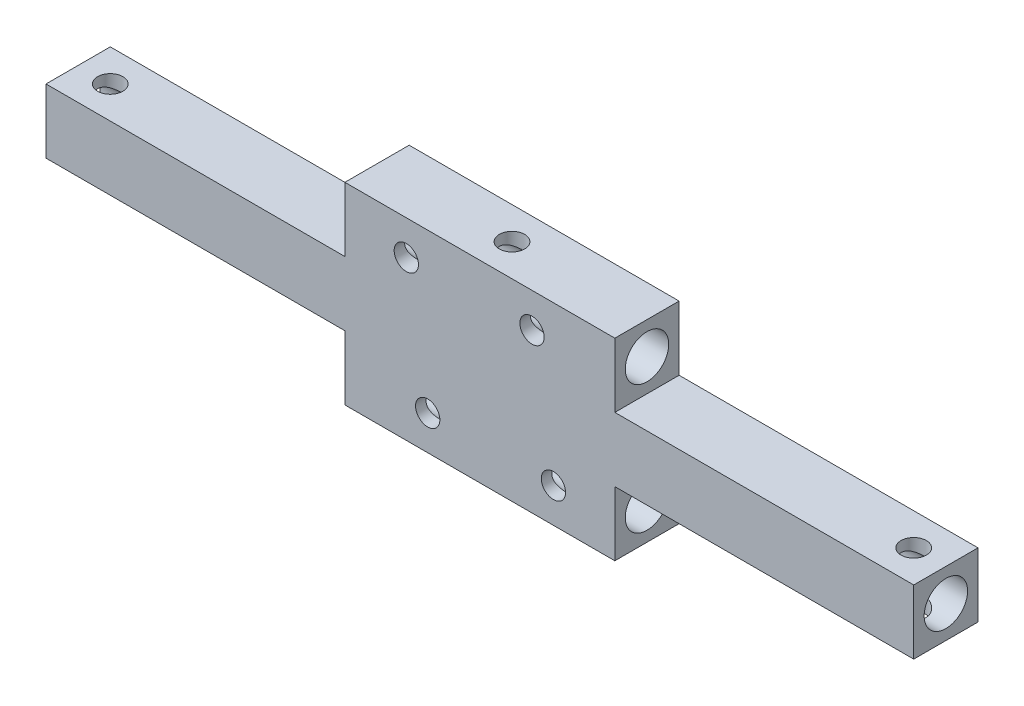
from build123d import *

# Parameters (mm, degrees)
SKETCH1_W           = 85.725
SKETCH1_H           = 6.35
SKETCH1_W_2         = 26.67
BOSS_EXTRUDE1_DEPTH = 6.35
SKETCH2_R           = 2.1463
CUT_EXTRUDE1_DEPTH  = 85.725
SKETCH4_R           = 2.1463
CUT_EXTRUDE2_DEPTH  = 26.67
SKETCH5_R           = 2.1463
CUT_EXTRUDE3_DEPTH  = 26.67
CUT_EXTRUDE4_REACH  = 49.333
SKETCH6_R           = 1.251498973
CUT_EXTRUDE6_REACH  = 47.153
SKETCH8_R           = 1.2
CUT_EXTRUDE7_REACH  = 47.153
SKETCH9_R           = 1.25


with BuildPart() as part:
    # Sketch1 → Boss-Extrude1 (new body)
    with BuildSketch(Plane.XY):
        with Locations((0, 3.175)):
            Rectangle(SKETCH1_W, SKETCH1_H)
        with Locations((0, -3.175)):
            Rectangle(SKETCH1_W_2, SKETCH1_H)
        with Locations((0, 9.525)):
            Rectangle(SKETCH1_W_2, SKETCH1_H)
    extrude(amount=BOSS_EXTRUDE1_DEPTH)

    # Sketch2 → Cut-Extrude1 (cut)
    with BuildSketch(Plane(origin=(42.8625, 0, 0), x_dir=(0, 0, -1), z_dir=(1, 0, 0))):
        with Locations(Location((-3.175, 3.175, 0), (0, 0, 90))):
            Circle(SKETCH2_R)
    extrude(amount=-CUT_EXTRUDE1_DEPTH, mode=Mode.SUBTRACT)

    # Sketch4 → Cut-Extrude2 (cut)
    with BuildSketch(Plane(origin=(13.335, 0, 0), x_dir=(0, 0, -1), z_dir=(1, 0, 0))):
        with Locations((-3.175, 9.525)):
            Circle(SKETCH4_R)
    extrude(amount=-CUT_EXTRUDE2_DEPTH, mode=Mode.SUBTRACT)

    # Sketch5 → Cut-Extrude3 (cut)
    with BuildSketch(Plane(origin=(13.335, 0, 0), x_dir=(0, 0, -1), z_dir=(1, 0, 0))):
        with Locations((-3.175, -3.175)):
            Circle(SKETCH5_R)
    extrude(amount=-CUT_EXTRUDE3_DEPTH, mode=Mode.SUBTRACT)

    # Cut-Extrude4: up to this face of the body (flat: up to its plane)
    cut_extrude4_end = Plane(part.part.faces().sort_by_distance((0, -6.35, 3.175))[0])
    # Sketch6 → Cut-Extrude4 (cut, up to the picked face)
    with BuildSketch(Plane(origin=(0, 12.7, 0), x_dir=(1, 0, 0), z_dir=(0, 1, 0)), mode=Mode.PRIVATE) as cut_extrude4_sk1:
        with Locations(Location((0, -3.175, 0), (0, 0, 270))):
            Circle(SKETCH6_R)
    cut_extrude4_tool1 = split(extrude(cut_extrude4_sk1.sketch, amount=-CUT_EXTRUDE4_REACH, mode=Mode.PRIVATE), bisect_by=cut_extrude4_end, keep=Keep.BOTH, mode=Mode.PRIVATE)
    add(cut_extrude4_tool1.solids().sort_by(Axis((0, 12.7, 3.175), (0, -1, 0)))[0], mode=Mode.SUBTRACT)

    # Cut-Extrude6: up to this face of the body (flat: up to its plane)
    cut_extrude6_end = Plane(part.part.faces().sort_by_distance((0, 3.175, 0))[0])
    # Sketch8 → Cut-Extrude6 (cut, up to the picked face)
    with BuildSketch(Plane.XY.offset(6.35), mode=Mode.PRIVATE) as cut_extrude6_sk1:
        with Locations((7.266656382, -2.944289585)):
            Circle(SKETCH8_R)
    cut_extrude6_tool1 = split(extrude(cut_extrude6_sk1.sketch, amount=-CUT_EXTRUDE6_REACH, mode=Mode.PRIVATE), bisect_by=cut_extrude6_end, keep=Keep.BOTH, mode=Mode.PRIVATE)
    # Sketch8 → Cut-Extrude6 (cut, up to the picked face)
    with BuildSketch(Plane.XY.offset(6.35), mode=Mode.PRIVATE) as cut_extrude6_sk2:
        with Locations((-5.153085966, -2.944289585)):
            Circle(SKETCH8_R)
    cut_extrude6_tool2 = split(extrude(cut_extrude6_sk2.sketch, amount=-CUT_EXTRUDE6_REACH, mode=Mode.PRIVATE), bisect_by=cut_extrude6_end, keep=Keep.BOTH, mode=Mode.PRIVATE)
    # Sketch8 → Cut-Extrude6 (cut, up to the picked face)
    with BuildSketch(Plane.XY.offset(6.35), mode=Mode.PRIVATE) as cut_extrude6_sk3:
        with Locations((5.153085966, 9.294289585)):
            Circle(SKETCH8_R)
    cut_extrude6_tool3 = split(extrude(cut_extrude6_sk3.sketch, amount=-CUT_EXTRUDE6_REACH, mode=Mode.PRIVATE), bisect_by=cut_extrude6_end, keep=Keep.BOTH, mode=Mode.PRIVATE)
    # Sketch8 → Cut-Extrude6 (cut, up to the picked face)
    with BuildSketch(Plane.XY.offset(6.35), mode=Mode.PRIVATE) as cut_extrude6_sk4:
        with Locations((-7.266656382, 9.294289585)):
            Circle(SKETCH8_R)
    cut_extrude6_tool4 = split(extrude(cut_extrude6_sk4.sketch, amount=-CUT_EXTRUDE6_REACH, mode=Mode.PRIVATE), bisect_by=cut_extrude6_end, keep=Keep.BOTH, mode=Mode.PRIVATE)
    add(cut_extrude6_tool1.solids().sort_by(Axis((7.266656, -2.94429, 6.35), (0, 0, -1)))[0], mode=Mode.SUBTRACT)
    add(cut_extrude6_tool2.solids().sort_by(Axis((-5.153086, -2.94429, 6.35), (0, 0, -1)))[0], mode=Mode.SUBTRACT)
    add(cut_extrude6_tool3.solids().sort_by(Axis((5.153086, 9.29429, 6.35), (0, 0, -1)))[0], mode=Mode.SUBTRACT)
    add(cut_extrude6_tool4.solids().sort_by(Axis((-7.266656, 9.29429, 6.35), (0, 0, -1)))[0], mode=Mode.SUBTRACT)

    # Cut-Extrude7: up to this face of the body (flat: up to its plane)
    cut_extrude7_end = Plane(part.part.faces().sort_by_distance((28.09875, 0, 3.175))[0])
    # Sketch9 → Cut-Extrude7 (cut, up to the picked face)
    with BuildSketch(Plane(origin=(0, 6.35, 0), x_dir=(1, 0, 0), z_dir=(0, 1, 0)), mode=Mode.PRIVATE) as cut_extrude7_sk1:
        with Locations(Location((39.6875, -3.175, 0), (0, 0, 270))):
            Circle(SKETCH9_R)
    cut_extrude7_tool1 = split(extrude(cut_extrude7_sk1.sketch, amount=-CUT_EXTRUDE7_REACH, mode=Mode.PRIVATE), bisect_by=cut_extrude7_end, keep=Keep.BOTH, mode=Mode.PRIVATE)
    # Sketch9 → Cut-Extrude7 (cut, up to the picked face)
    with BuildSketch(Plane(origin=(0, 6.35, 0), x_dir=(1, 0, 0), z_dir=(0, 1, 0)), mode=Mode.PRIVATE) as cut_extrude7_sk2:
        with Locations(Location((-39.6875, -3.175, 0), (0, 0, 270))):
            Circle(SKETCH9_R)
    cut_extrude7_tool2 = split(extrude(cut_extrude7_sk2.sketch, amount=-CUT_EXTRUDE7_REACH, mode=Mode.PRIVATE), bisect_by=cut_extrude7_end, keep=Keep.BOTH, mode=Mode.PRIVATE)
    add(cut_extrude7_tool1.solids().sort_by(Axis((39.6875, 6.35, 3.175), (0, -1, 0)))[0], mode=Mode.SUBTRACT)
    add(cut_extrude7_tool2.solids().sort_by(Axis((-39.6875, 6.35, 3.175), (0, -1, 0)))[0], mode=Mode.SUBTRACT)


solid = part.part
